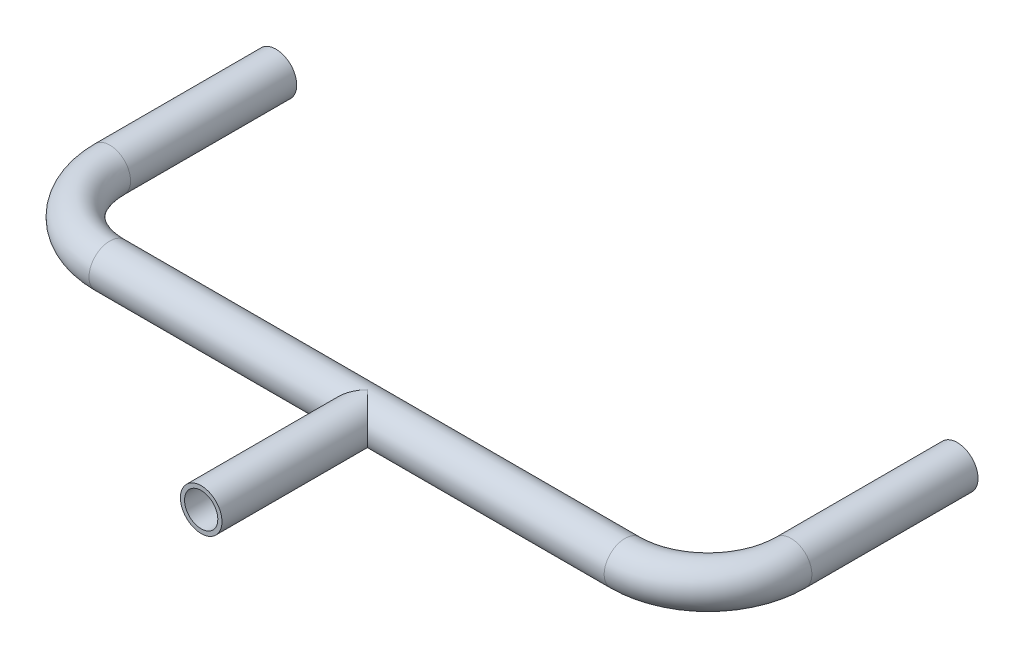
from build123d import *

# Parameters (mm, degrees)
SKETCH3_R           = 2.5
SKETCH3_R_2         = 2
SKETCH5_R           = 2.5
SKETCH5_R_2         = 2
BOSS_EXTRUDE2_DEPTH = 20


with BuildPart() as part:
    # Sweep1: sweep along a path in Sketch2
    with BuildLine(Plane(origin=(0, 0, 0), x_dir=(1, 0, 0), z_dir=(0, 1, 0))) as sweep1_path:
        Line((-41, 0), (-41, -20))
        ThreePointArc((-41, -20), (-38.071067812, -27.071067812), (-31, -30))
        Line((-31, -30), (31, -30))
        ThreePointArc((31, -30), (38.071067812, -27.071067812), (41, -20))
        Line((41, -20), (41, 0))
    # Sketch3 → Sweep1 (sweep)
    with BuildSketch(Plane.XY):
        with Locations((-41, 0)):
            Circle(SKETCH3_R)
        with Locations((-41, 0)):
            Circle(SKETCH3_R_2, mode=Mode.SUBTRACT)
    sweep(path=sweep1_path.line)

    # Sketch5 → Boss-Extrude2 (add)
    with BuildSketch(Plane.XY.offset(30)):
        Circle(SKETCH5_R)
        with Locations(Location((0, 0, 0), (0, 0, 180))):
            Circle(SKETCH5_R_2, mode=Mode.SUBTRACT)
    extrude(amount=BOSS_EXTRUDE2_DEPTH)


solid = part.part
